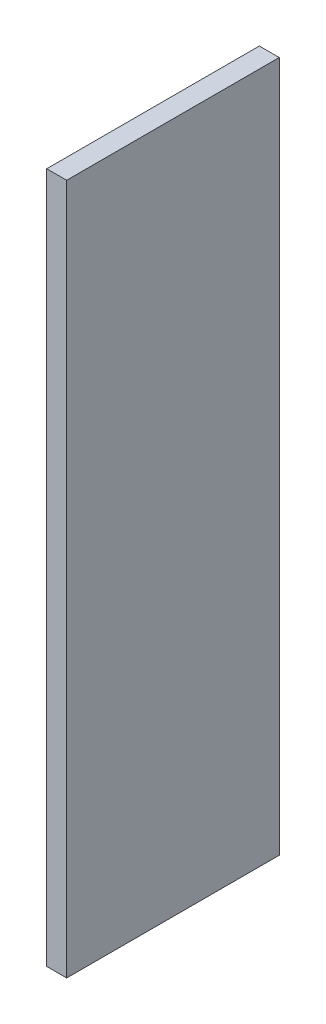
from build123d import *

# Parameters (mm, degrees)
SKETCH1_W           = 203.2
SKETCH1_H           = 660.4
BOSS_EXTRUDE1_DEPTH = 19.05


with BuildPart() as part:
    # Sketch1 → Boss-Extrude1 (new body)
    with BuildSketch(Plane(origin=(0, 0, 0), x_dir=(0, 0, -1), z_dir=(1, 0, 0))):
        with Locations((71.133366082, 282.219612452)):
            Rectangle(SKETCH1_W, SKETCH1_H)
    extrude(amount=BOSS_EXTRUDE1_DEPTH)


solid = part.part
